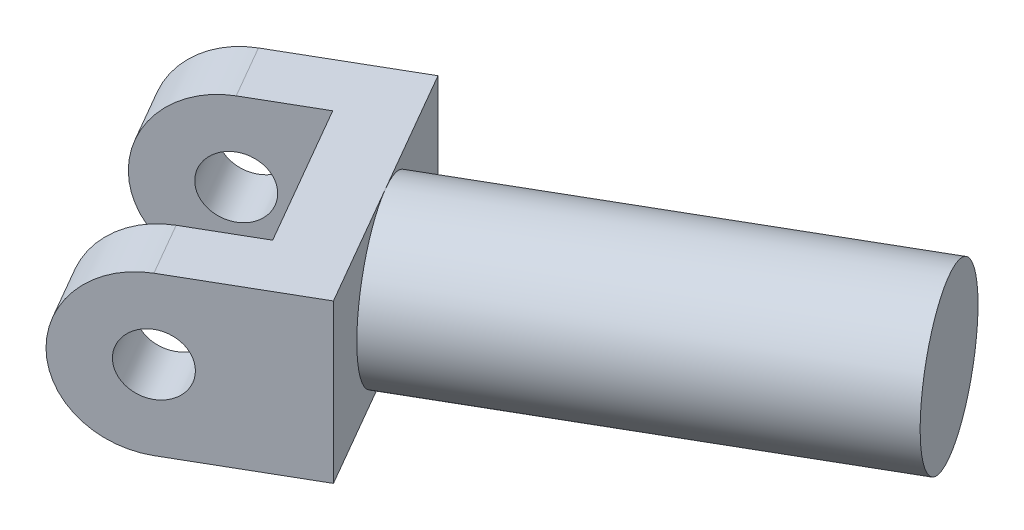
from build123d import *
from build123d.topology import SkipClean

# Parameters (mm, degrees)
BOSS_EXTRUDE1_DEPTH = 25
SKETCH2_R           = 8
CUT_EXTRUDE1_DEPTH  = 110
CUT_EXTRUDE2_DEPTH  = 150
BOSS_EXTRUDE2_START = 21.60254038
BOSS_EXTRUDE2_DEPTH = 21.60254038
SKETCH5_R           = 13
CUT_EXTRUDE3_DEPTH  = 50
SKETCH6_R           = 13
BOSS_EXTRUDE3_DEPTH = 100
SKETCH7_R           = 5
CUT_EXTRUDE4_DEPTH  = 50
SKETCH8_R           = 13
SKETCH8_R_2         = 5
BOSS_EXTRUDE4_DEPTH = 13
CUT_EXTRUDE5_DEPTH  = 28
SKETCH10_R          = 5
BOSS_EXTRUDE5_DEPTH = 10
CIRPATTERN2_COUNT   = 2
SKETCH11_W          = 47
SKETCH11_H          = 26
BOSS_EXTRUDE6_DEPTH = 10
SKETCH12_R          = 13
BOSS_EXTRUDE7_DEPTH = 67.86279097


with BuildPart() as part:
    # Sketch1 → Boss-Extrude1 (new, symmetric)
    with BuildSketch(Plane(origin=(0, 0, 0), x_dir=(1, 0, 0), z_dir=(0, 1, 0))):
        Polygon((86.602540378, 150), (103.923048454, 160), (114.724318643, 141.291651246), (93.073683549, 128.791651246), (158.073683549, 16.208348754), (179.724318643, 28.708348754), (190.525588833, 10), (173.205080757, 0), (45.59802172, 0), (22.79901086, 39.489045172), align=None)
    extrude(amount=BOSS_EXTRUDE1_DEPTH, both=True)

    # Sketch2 → Cut-Extrude1 (cut, symmetric)
    with BuildSketch(Plane(origin=(140.729128115, 0, -81.25), x_dir=(0.8660254037844386, 0, -0.5000000000000003), z_dir=(0.5000000000000003, 0, 0.8660254037844386))):
        Circle(SKETCH2_R)
    extrude(amount=CUT_EXTRUDE1_DEPTH, both=True, mode=Mode.SUBTRACT)

    # Sketch3 → Cut-Extrude2 (cut, symmetric)
    with BuildSketch(Plane(origin=(140.729128115, 0, -81.25), x_dir=(0.8660254037844386, 0, -0.5000000000000003), z_dir=(0.5000000000000003, 0, 0.8660254037844386))):
        with BuildLine():
            Line((0, 18), (-12.5, 18))
            Line((-12.5, 18), (-12.5, 31.312178452))
            Line((-12.5, 31.312178452), (23.905899442, 31.312178452))
            Line((23.905899442, 31.312178452), (23.905899442, -29.505210198))
            Line((23.905899442, -29.505210198), (-12.5, -29.505210198))
            Line((-12.5, -29.505210198), (-12.5, -18))
            Line((-12.5, -18), (0, -18))
            ThreePointArc((0, -18), (18, 0), (0, 18))
        make_face()
    extrude(amount=CUT_EXTRUDE2_DEPTH, both=True, mode=Mode.SUBTRACT)

    # Sketch4 → Boss-Extrude2 (add)
    with SkipClean():  # the faces are left unmerged after this step: merging them gives an invalid solid
        with BuildSketch(Plane(origin=(173.229128115, 0, -24.958348754), x_dir=(0.8660254037844386, 0, -0.5000000000000003), z_dir=(0.5000000000000003, 0, 0.8660254037844386)).offset(BOSS_EXTRUDE2_START)):
            with BuildLine():
                Line((7.5, 16.363068172), (7.5, 2.783882181))
                ThreePointArc((7.5, 2.783882181), (8, 0), (7.5, -2.783882181))
                Line((7.5, -2.783882181), (7.5, -16.363068172))
                ThreePointArc((7.5, -16.363068172), (18, 0), (7.5, 16.363068172))
            make_face()
        boss_extrude2 = extrude(amount=-BOSS_EXTRUDE2_DEPTH)

    # Mirror2: Boss-Extrude2 across plane
    with SkipClean():  # the faces are left unmerged after this step: merging them gives an invalid solid
        add(boss_extrude2.mirror(Plane(origin=(140.729128115, 0, -81.25), x_dir=(-0.8660254037844388, 0, 0.5), z_dir=(0.5000000000000003, 0, 0.8660254037844386))))

    # Sketch5 → Cut-Extrude3 (cut)
    with SkipClean():  # the faces are left unmerged after this step: merging them gives an invalid solid
        with BuildSketch(Plane(origin=(34.19851629, 0, -19.744522586), x_dir=(0.5000000000000001, 0, 0.8660254037844386), z_dir=(-0.8660254037844386, 0, 0.5000000000000001))):
            Circle(SKETCH5_R)
        extrude(amount=-CUT_EXTRUDE3_DEPTH, mode=Mode.SUBTRACT)


with BuildPart() as body_2:
    # Sketch6 → Boss-Extrude3 (new body)
    with BuildSketch(Plane(origin=(77.499786479, 0, -44.744522586), x_dir=(0.5000000000000001, 0, 0.8660254037844386), z_dir=(-0.8660254037844386, 0, 0.5000000000000001))):
        Circle(SKETCH6_R)
    extrude(amount=BOSS_EXTRUDE3_DEPTH)

    # Sketch7 → Cut-Extrude4 (cut, symmetric)
    with BuildSketch(Plane(origin=(140.729128115, 0, -81.25), x_dir=(0.8660254037844386, 0, -0.5000000000000003), z_dir=(0.5000000000000003, 0, 0.8660254037844386))):
        with Locations((-162.5, 0)):
            Circle(SKETCH7_R)
    extrude(amount=CUT_EXTRUDE4_DEPTH, both=True, mode=Mode.SUBTRACT)

    # Sketch8 → Boss-Extrude4 (add, symmetric)
    with BuildSketch(Plane(origin=(140.729128115, 0, -81.25), x_dir=(0.8660254037844386, 0, -0.5000000000000003), z_dir=(0.5000000000000003, 0, 0.8660254037844386))):
        with Locations((-162.5, 0)):
            Circle(SKETCH8_R)
        with Locations((-162.5, 0)):
            Circle(SKETCH8_R_2, mode=Mode.SUBTRACT)
    extrude(amount=BOSS_EXTRUDE4_DEPTH, both=True)

    # Sketch9 → Cut-Extrude5 (cut, symmetric)
    with BuildSketch(Plane(origin=(140.729128115, 0, -81.25), x_dir=(0.8660254037844386, 0, -0.5000000000000003), z_dir=(0.5000000000000003, 0, 0.8660254037844386))):
        with BuildLine():
            Line((-162.5, 13), (-162.5, 18.834095503))
            ThreePointArc((-162.5, 18.834095503), (-181.334095503, 0), (-162.5, -18.834095503))
            Line((-162.5, -18.834095503), (-162.5, -13))
            ThreePointArc((-162.5, -13), (-175.5, 0), (-162.5, 13))
        make_face()
    extrude(amount=CUT_EXTRUDE5_DEPTH, both=True, mode=Mode.SUBTRACT)


with BuildPart() as body_2_2:
    # Sketch10 → Boss-Extrude5 (new body)
    with BuildSketch(Plane(origin=(6.75, 0, 11.691342951), x_dir=(0.8660254037844385, 0, -0.5000000000000004), z_dir=(0.5000000000000003, 0, 0.8660254037844384))):
        with BuildLine():
            Line((0, 13), (21.626254201, 13))
            Line((21.626254201, 13), (21.626254201, -13))
            Line((21.626254201, -13), (0, -13))
            ThreePointArc((0, -13), (-13, 0), (0, 13))
        make_face()
        Circle(SKETCH10_R, mode=Mode.SUBTRACT)
    extrude(amount=BOSS_EXTRUDE5_DEPTH)


with BuildPart() as cirpattern2_1:
    # CirPattern2: pattern copy
    add(body_2_2.part.rotate(Axis((24.24994662, 0, -14.000713209), (0.8660254037844386, 0, -0.5000000000000003)), 1 * 360 / CIRPATTERN2_COUNT))


with BuildPart() as body_4:
    # Sketch11 → Boss-Extrude6 (new body)
    with BuildSketch(Plane(origin=(18.728885527, 0, -10.8131271), x_dir=(-0.5000000000000004, 0, -0.8660254037844385), z_dir=(0.8660254037844384, 0, -0.5000000000000003))):
        Rectangle(SKETCH11_W, SKETCH11_H)
    extrude(amount=-BOSS_EXTRUDE6_DEPTH)


with BuildPart() as body_5:
    # Sketch12 → Boss-Extrude7 (new body)
    with BuildSketch(Plane(origin=(18.728885527, 0, -10.8131271), x_dir=(-0.5000000000000004, 0, -0.8660254037844385), z_dir=(0.8660254037844384, 0, -0.5000000000000003))):
        Circle(SKETCH12_R)
    extrude(amount=BOSS_EXTRUDE7_DEPTH)


with BuildPart() as cirpattern2_1_1:
    add(cirpattern2_1.part)

    # Combine2: union body 4, body 5, body 2 2
    add(body_4.part)
    add(body_5.part)
    add(body_2_2.part)


solid = cirpattern2_1_1.part
